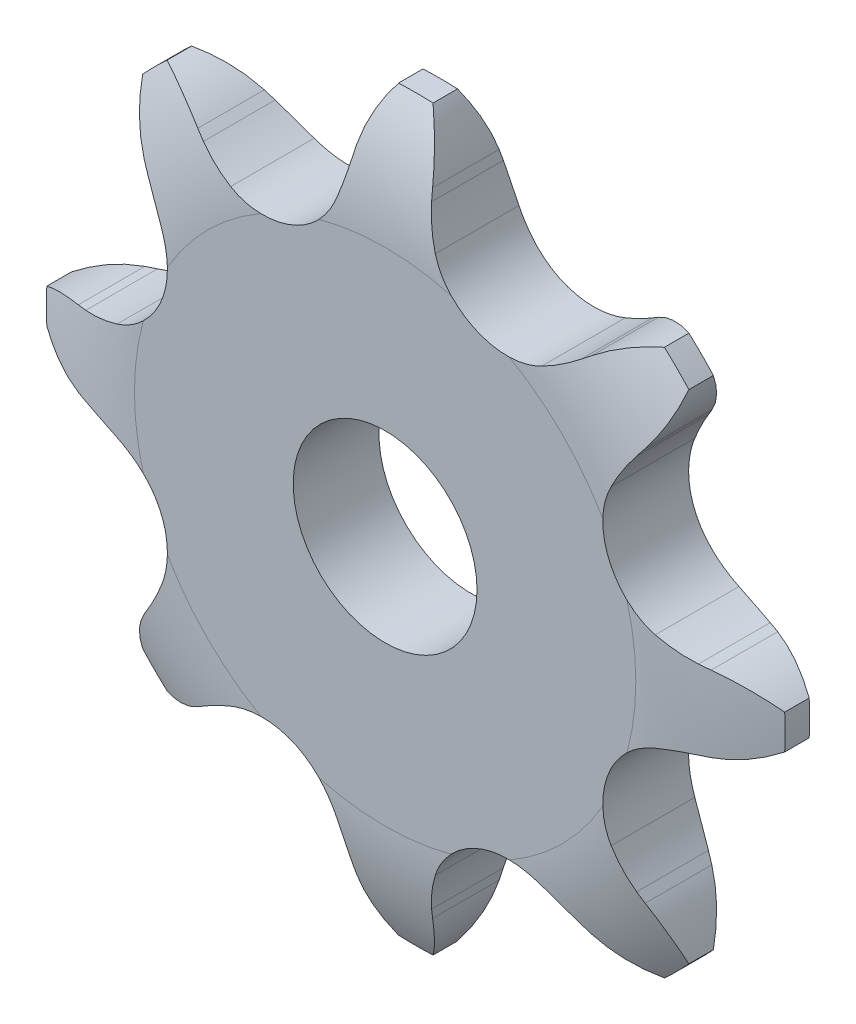
from build123d import *

# Parameters (mm, degrees)
CUT_EXTRUDE1_DEPTH      = 18.108345004
CIRPATTERN1_COUNT       = 8
BOSS_EXTRUDE1_START     = 1.4
SKETCH2_R               = 6.5
BOSS_EXTRUDE1_DEPTH     = 9.2
CUT_EXTRUDE2_DEPTH      = 21.077237699
CUT_EXTRUDE2_DEPTH_BACK = 21.077237699
SKETCH3_R               = 3
SKETCH4_W               = 2.1
SKETCH4_H               = 6.90435053
SKETCH6_R               = 9
CUT_EXTRUDE4_DEPTH      = 10


with BuildPart() as part:
    # Sketch1 → Revolve1 (revolve)
    with BuildSketch(Plane(origin=(0, 0, 0), x_dir=(0, 0, -1), z_dir=(1, 0, 0))):
        with BuildLine():
            Line((1.4, 0), (-1.4, 0))
            Line((-1.4, 0), (-1.4, 8.183870903))
            ThreePointArc((-1.4, 8.183870903), (-1.145966692, 10.183870903), (-0.4, 12.056854249))
            Line((-0.4, 12.056854249), (0.4, 12.056854249))
            ThreePointArc((0.4, 12.056854249), (1.145966692, 10.183870903), (1.4, 8.183870903))
            Line((1.4, 8.183870903), (1.4, 0))
        make_face()
    revolve(axis=Axis((0, 0, -1.4), (0, 0, 1)))

    # Sketch0 → Cut-Extrude1 (cut, symmetric)
    with BuildSketch(Plane.XY):
        with BuildLine():
            Line((6.428309132, -8.177568921), (6.159873027, -7.982538674))
            ThreePointArc((6.159873027, -7.982538674), (5.634207753, -7.637897419), (5.077930138, -7.345225608))
            ThreePointArc((5.077930138, -7.345225608), (3.023927637, -7.300407114), (1.603220001, -8.784497672))
            ThreePointArc((1.603220001, -8.784497672), (1.41682255, -9.384795568), (1.288819239, -10.000195216))
            Line((1.288819239, -10.000195216), (1.236913459, -10.327915416))
            ThreePointArc((1.236913459, -10.327915416), (-0.73498539, -13.299856797), (-4.272650045, -13.753452913))
            ThreePointArc((-4.272650045, -13.753452913), (5.511345697, -13.305565529), (12.74637964, -6.703939999))
            ThreePointArc((12.74637964, -6.703939999), (9.924132084, -8.884705777), (6.428309132, -8.177568921))
        make_face()
    cut_extrude1 = extrude(amount=CUT_EXTRUDE1_DEPTH, both=True, mode=Mode.SUBTRACT)

    # CirPattern1: Cut-Extrude1 ×8 about axis
    cirpattern1_axis = Axis((0, 0, 0), (0, 0, 1))
    for i in range(1, CIRPATTERN1_COUNT):
        add(cut_extrude1.rotate(cirpattern1_axis, i * 360 / CIRPATTERN1_COUNT), mode=Mode.SUBTRACT)

    # Sketch2 → Boss-Extrude1 (add)
    with BuildSketch(Plane.XY.offset(BOSS_EXTRUDE1_START)):
        with Locations(Location((0, 0, 0), (0, 0, 270))):
            Circle(SKETCH2_R)
    extrude(amount=BOSS_EXTRUDE1_DEPTH)

    # Sketch3 → Cut-Extrude2 (cut, two sides: drawn at the far end of the back side and taken through both)
    with BuildSketch(Plane.XY.offset(-CUT_EXTRUDE2_DEPTH_BACK)):
        Circle(SKETCH3_R)
    extrude(amount=CUT_EXTRUDE2_DEPTH + CUT_EXTRUDE2_DEPTH_BACK, mode=Mode.SUBTRACT)

    # Sketch4 → Cut-Revolve1 (revolve, cut)
    with BuildSketch(Plane(origin=(0, 0, 0), x_dir=(0, 0, -1), z_dir=(1, 0, 0))):
        Polygon((-10.6, 6.5), (-10.6, 6), (-10.1, 6.5), align=None)
        with Locations((-2.45, 8.604678984)):
            Rectangle(SKETCH4_W, SKETCH4_H)
    revolve(axis=Axis((0, 0, -1.4), (0, 0, 1)), mode=Mode.SUBTRACT)

    # Sketch6 → Cut-Extrude4 (cut)
    with BuildSketch(Plane.XY.offset(1.4)):
        Circle(SKETCH6_R)
    extrude(amount=CUT_EXTRUDE4_DEPTH, mode=Mode.SUBTRACT)


solid = part.part
